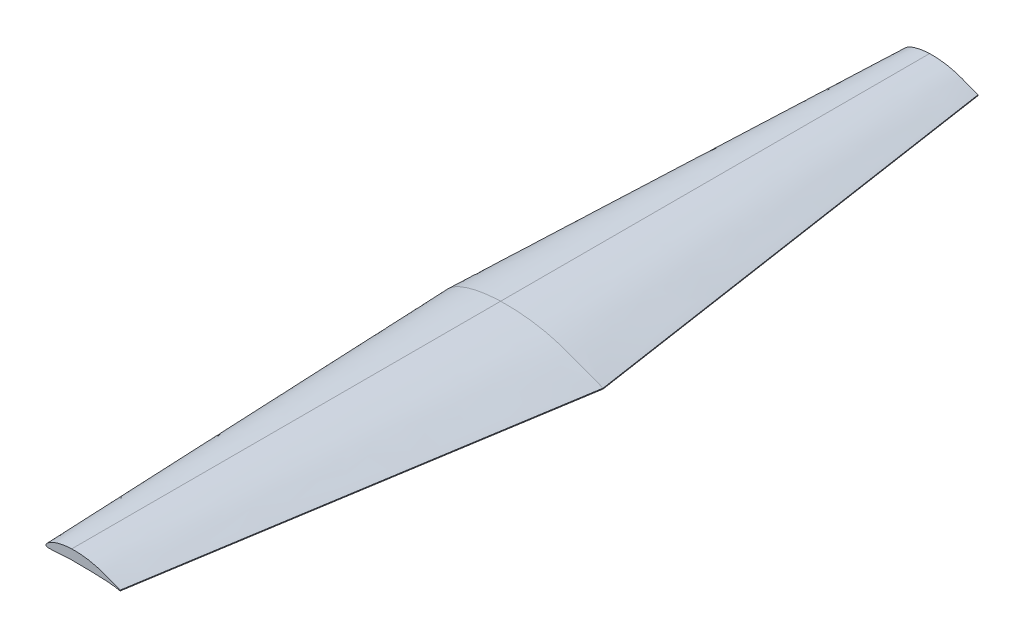
from build123d import *


with BuildPart() as part:
    # 草图8 → 放样2 section 0
    with BuildSketch(Plane.XY.offset(1198)):
        with BuildLine():
            Line((135.209931069, -32.178036718), (135.213870996, -34.389411227))
            add(Edge.make_bspline(
                [(0, 0), (-2.202780391, 0.091358835), (-5.066933977, -0.107193947), (-8.595540889, -0.40058662), (-10.598824702, -0.584365016), (-12.594909645, -0.789363221), (-14.582358537, -1.014151874), (-16.561736061, -1.256795766), (-18.531566578, -1.522769302), (-20.492661157, -1.808349138), (-22.444734443, -2.115732319), (-24.387261164, -2.44474085), (-26.320861136, -2.795884041), (-28.2437018, -3.169577011), (-30.156841195, -3.563009805), (-32.057194603, -3.983448892), (-33.94684572, -4.423220433), (-35.822405413, -4.887724757), (-37.683720928, -5.372265553), (-39.525083517, -5.880876853), (-41.345636367, -6.405162293), (-43.137906373, -6.956708302), (-44.903037206, -7.523443906), (-46.634160328, -8.116953725), (-48.32980777, -8.726761931), (-49.98510916, -9.357484775), (-51.595366468, -10.008335071), (-53.156323053, -10.677771471), (-54.665636895, -11.359543861), (-56.114139393, -12.066874929), (-57.504840801, -12.785022278), (-58.831295239, -13.515210699), (-60.088611751, -14.247465776), (-61.268933962, -14.976942234), (-62.368330165, -15.69098987), (-63.380444878, -16.383167415), (-64.30481932, -17.045044317), (-65.139465709, -17.677475763), (-65.891920358, -18.273720545), (-66.568305414, -18.833500649), (-67.172709641, -19.360583673), (-67.71443902, -19.854042266), (-68.203103927, -20.312676309), (-68.642046763, -20.741820119), (-69.040305995, -21.140628988), (-69.402115625, -21.512434252), (-69.732559053, -21.858727529), (-70.030456468, -22.187324537), (-70.300199908, -22.499385775), (-70.543446323, -22.798645065), (-70.76067965, -23.08787102), (-70.956434934, -23.366848156), (-71.13127491, -23.637367618), (-71.282846404, -23.902645952), (-71.411417301, -24.163194525), (-71.522923974, -24.417240588), (-71.609672251, -24.668765332), (-71.671556616, -24.916361189), (-71.718277745, -25.158309239), (-71.729236703, -25.423881003), (-71.752919399, -25.697565417), (-71.744031425, -25.989631455), (-71.744468982, -26.256218596), (-71.732189572, -26.512056511), (-71.714527731, -26.755218422), (-71.645463866, -26.995423065), (-71.555418319, -27.234948027), (-71.436968717, -27.470675934), (-71.292739306, -27.701213929), (-71.12439285, -27.926520961), (-70.93497885, -28.147839563), (-70.721773473, -28.362361597), (-70.485066327, -28.569235173), (-70.23039799, -28.774915494), (-69.947774897, -28.96783401), (-69.641046574, -29.151737698), (-69.308271189, -29.325926651), (-68.946551815, -29.4856318), (-68.550067334, -29.620133262), (-68.121440872, -29.740942638), (-67.65385036, -29.838832587), (-67.144273887, -29.916721398), (-66.587417435, -29.983504456), (-65.975930951, -30.039405133), (-65.302748448, -30.09517437), (-64.557732475, -30.145396625), (-63.730117595, -30.18196386), (-62.80859823, -30.213152275), (-61.780332898, -30.227118801), (-60.633044068, -30.223118223), (-59.35254531, -30.198077949), (-57.927837896, -30.144124136), (-56.351825826, -30.073031756), (-54.632563698, -29.981677994), (-52.788275227, -29.882850304), (-50.847542509, -29.768183302), (-48.832696889, -29.64386057), (-46.762029284, -29.500079768), (-44.645966559, -29.351697969), (-42.495564653, -29.191088101), (-40.321225615, -29.031280241), (-38.133466545, -28.868275364), (-35.941346143, -28.707234399), (-33.749097924, -28.54899602), (-31.558171008, -28.394570921), (-29.3683878, -28.243897038), (-27.17999416, -28.096664901), (-24.99355742, -27.953882627), (-22.810564332, -27.815408912), (-20.629846742, -27.680783752), (-18.451577761, -27.553739306), (-16.275174836, -27.427618942), (-14.1000592, -27.310976066), (-11.928203446, -27.195365981), (-9.756790356, -27.082668238), (-7.585054768, -26.986688356), (-4.84020886, -26.83660713), (-2.293690571, -26.832659038), (0.192633575, -26.80621402), (2.528388695, -26.775759877), (5.064880595, -26.793829693), (7.656066485, -26.753306062), (9.819586732, -26.734899742), (11.981570719, -26.717954048), (14.14311819, -26.7105429), (16.309111986, -26.702242479), (18.478201845, -26.703109053), (20.652366541, -26.704051385), (22.830601734, -26.714203263), (25.013516351, -26.726726118), (27.199492989, -26.74425363), (29.387291727, -26.766066118), (31.577330769, -26.792367118), (33.767781241, -26.822738074), (35.957232671, -26.855437371), (38.142974754, -26.89238563), (40.324976652, -26.934867183), (42.500023687, -26.97916779), (44.667672301, -27.027727839), (46.827725747, -27.079875173), (48.986401574, -27.133738247), (51.147482045, -27.194798989), (53.317810229, -27.252629519), (55.498215574, -27.322280564), (57.687259084, -27.388908359), (59.880971389, -27.462196173), (62.076359363, -27.538787895), (64.27171153, -27.614949846), (66.465371093, -27.696900971), (68.656226461, -27.78116923), (70.842765027, -27.864607167), (73.022565907, -27.951369884), (75.196846366, -28.041865827), (77.371516617, -28.127318583), (79.549710818, -28.221816362), (81.731130669, -28.312321153), (83.911940369, -28.407022356), (86.088360677, -28.507107951), (88.257018575, -28.609700928), (90.416599377, -28.71673411), (92.565568338, -28.833742766), (94.704030268, -28.954988837), (96.832268594, -29.086660872), (98.948842436, -29.228407609), (101.05615976, -29.378567382), (103.151449358, -29.541433526), (105.238188737, -29.715178714), (107.314091817, -29.904431539), (109.380311723, -30.101652277), (111.433612999, -30.315335325), (113.476042901, -30.544043556), (115.505501179, -30.789189395), (117.520665114, -31.043734188), (119.51623903, -31.318244295), (121.48881211, -31.604655615), (123.433018362, -31.906253356), (125.340662374, -32.223393708), (127.209581947, -32.557856223), (129.034668461, -32.916520553), (130.817570206, -33.292296767), (132.875674245, -33.77223973), (134.335399164, -34.144171736), (135.213870996, -34.389411227)],
                knots=[0, 0, 0, 0, 0.022815026, 0.029793973, 0.036758676, 0.043698396, 0.050624438, 0.057522114, 0.064400195, 0.071258833, 0.078095057, 0.084914364, 0.091711426, 0.098496006, 0.105248918, 0.111987197, 0.118700521, 0.12538957, 0.132045517, 0.138666649, 0.145220531, 0.151712441, 0.158132976, 0.16446531, 0.170709486, 0.176838849, 0.18285338, 0.18873844, 0.194469917, 0.200044378, 0.20547074, 0.210716918, 0.215761415, 0.220573902, 0.225119984, 0.229369276, 0.233302014, 0.236921244, 0.240239232, 0.243267886, 0.246034893, 0.24856357, 0.250874757, 0.252991779, 0.254935992, 0.256725611, 0.258377427, 0.259904748, 0.261329497, 0.262659097, 0.263907391, 0.265083801, 0.266196477, 0.267250058, 0.268253498, 0.269211478, 0.270128622, 0.271011218, 0.271860259, 0.272680143, 0.273766732, 0.27470966, 0.27571044, 0.276533643, 0.277370223, 0.278232175, 0.279115768, 0.28002553, 0.280965187, 0.281935454, 0.282942642, 0.283987031, 0.285072051, 0.28620494, 0.287383253, 0.288620993, 0.289915894, 0.291280333, 0.292721069, 0.294258424, 0.295901055, 0.2976767, 0.299608471, 0.301722499, 0.304050746, 0.306620881, 0.30947361, 0.312650372, 0.316192577, 0.32014851, 0.324560292, 0.329487536, 0.334948887, 0.340937813, 0.347360694, 0.354122343, 0.361120111, 0.368316957, 0.375670101, 0.383141402, 0.390702936, 0.398303336, 0.40591601, 0.413521193, 0.4211208, 0.428716972, 0.436307608, 0.443890394, 0.451463234, 0.459015333, 0.466572018, 0.47411479, 0.481646979, 0.489184806, 0.496693366, 0.504218963, 0.511752726, 0.525226611, 0.530645438, 0.537566507, 0.549475995, 0.556976056, 0.564468775, 0.571936885, 0.579420773, 0.586908434, 0.594422732, 0.601938595, 0.609478945, 0.617035725, 0.624600336, 0.632172809, 0.639748912, 0.647337287, 0.654914587, 0.66248067, 0.670031225, 0.677570761, 0.68506504, 0.69253974, 0.700001338, 0.707481727, 0.714983389, 0.722539991, 0.73012854, 0.737718905, 0.745326127, 0.752933269, 0.760523089, 0.768114907, 0.775693893, 0.783238596, 0.790761854, 0.798285167, 0.805831766, 0.813395456, 0.8209505, 0.828492594, 0.836013266, 0.843489046, 0.850939181, 0.858355231, 0.865724552, 0.873075067, 0.880377055, 0.887656479, 0.894892271, 0.90211478, 0.909296178, 0.916439553, 0.923545459, 0.930631395, 0.937660861, 0.944631335, 0.951542678, 0.958353151, 0.965055621, 0.971617827, 0.978062285, 0.984364015, 0.990532122, 1, 1, 1, 1], degree=3))
            add(Edge.make_bspline(
                [(0, 0), (1.364177383, -0.043580484), (3.40511211, 0.031785466), (6.126174412, 0.046317508), (8.163369993, 0.042034579), (10.202341065, 0.024632669), (12.243632765, -0.014718201), (14.285791623, -0.071535099), (16.33005737, -0.141611523), (18.374864569, -0.233782806), (20.420336352, -0.33952236), (22.466615554, -0.461741022), (24.512326345, -0.604724804), (26.557931093, -0.759082618), (28.602909036, -0.932219371), (30.646686054, -1.122867063), (32.690051754, -1.327460959), (34.730959589, -1.551335071), (36.769855137, -1.787232728), (38.805253719, -2.043785452), (40.837281962, -2.312141876), (42.86440918, -2.600154373), (44.885925913, -2.900137538), (46.899623365, -3.218777349), (48.906543004, -3.553138057), (50.90668819, -3.908855135), (52.902158516, -4.277915924), (54.890413346, -4.667021702), (56.872665333, -5.072059584), (58.848118799, -5.49945616), (60.81994798, -5.94113471), (62.786078547, -6.406405579), (64.749272393, -6.886045719), (66.708203306, -7.388321513), (68.664194752, -7.907189189), (70.616577724, -8.444276181), (72.565250087, -9.000437135), (74.511299909, -9.577544795), (76.455756627, -10.171074315), (78.40052315, -10.783255133), (80.34437156, -11.419751661), (82.294354664, -12.069499879), (84.248540115, -12.743775362), (86.211553287, -13.4371317), (88.185525617, -14.144718735), (90.169632588, -14.87147557), (92.164798795, -15.614273969), (94.173103566, -16.368816428), (96.190660078, -17.135391658), (98.214444653, -17.90699033), (100.239036083, -18.684211238), (102.263137267, -19.463565274), (104.291890319, -20.241303458), (106.326485515, -21.026488563), (108.37158412, -21.811343877), (110.422710682, -22.598834241), (112.476717862, -23.387201909), (114.5322703, -24.171762643), (116.585411889, -24.954501881), (118.634417569, -25.733588716), (120.677366225, -26.503975919), (122.707346352, -27.271641379), (124.718603391, -28.025197231), (126.697129524, -28.774077744), (128.6346755, -29.515303083), (130.524957495, -30.254339005), (132.714523361, -31.133421324), (134.270056434, -31.776449602), (135.209931069, -32.178036718)],
                knots=[0, 0, 0, 0, 0.029181925, 0.043684306, 0.05821854, 0.072769694, 0.087310923, 0.101901178, 0.116480204, 0.131074947, 0.145695494, 0.160303153, 0.174934264, 0.189571701, 0.20419485, 0.218844298, 0.233489695, 0.248132595, 0.262772927, 0.277404235, 0.292025903, 0.306627086, 0.321211566, 0.335751321, 0.350247482, 0.364742609, 0.379217205, 0.393665958, 0.408089509, 0.42250488, 0.436909904, 0.451323334, 0.465733172, 0.480149118, 0.494591476, 0.50903039, 0.523473295, 0.53794923, 0.552459595, 0.566971359, 0.58157126, 0.596222383, 0.610947788, 0.625801042, 0.640765661, 0.655813942, 0.671010731, 0.686316459, 0.701716069, 0.717189064, 0.732657604, 0.748116304, 0.763595919, 0.779144946, 0.794777511, 0.810464338, 0.826153996, 0.841850806, 0.857539391, 0.873166992, 0.888753242, 0.90425474, 0.919602178, 0.934707133, 0.949517979, 0.96398757, 0.97813205, 1, 1, 1, 1], degree=3))
        make_face()
    # 草图3 → 放样2 section 1
    with BuildSketch(Plane.XY):
        with BuildLine():
            Line((286.055608228, -67.209266366), (286.055608228, -69.532766948))
            add(Edge.make_bspline(
                [(0, 0), (-2.725444694, 0.16479075), (-6.529329099, -0.138331244), (-11.397016018, -0.405348512), (-15.713874629, -0.64444661), (-21.121913216, -1.041627107), (-27.619648691, -1.602920243), (-34.105982036, -2.270964793), (-40.579797503, -3.043587525), (-47.038279723, -3.931652037), (-53.479734263, -4.935955417), (-58.854414584, -5.877356762), (-63.169985024, -6.70024074), (-66.434425741, -7.357914384), (-69.691963936, -8.046339188), (-72.941077321, -8.77256441), (-76.183155264, -9.529979299), (-79.417200801, -10.323559167), (-82.671188627, -11.161789957), (-85.94521275, -12.041440017), (-89.23632109, -12.971017746), (-92.514827659, -13.941881935), (-95.77914161, -14.959856385), (-99.028801968, -16.02419143), (-102.262401726, -17.140269432), (-104.962526081, -18.121694649), (-107.136544699, -18.945165575), (-108.791541193, -19.589414389), (-110.439200679, -20.250087878), (-112.080238251, -20.92601665), (-113.436360447, -21.514562153), (-114.799567501, -22.084744275), (-116.429788539, -22.849639447), (-118.360299468, -23.734628468), (-120.291408253, -24.685432883), (-121.948548066, -25.524658599), (-123.593652926, -26.392003285), (-125.229519218, -27.284016058), (-126.855596581, -28.204859765), (-128.517200827, -29.17741547), (-130.21083081, -30.205442861), (-131.930502415, -31.291558288), (-133.628269536, -32.406389376), (-135.298492236, -33.546499842), (-136.932725116, -34.7128219), (-138.527730347, -35.899250832), (-139.87977025, -36.956117217), (-141.006081118, -37.869529498), (-141.921591236, -38.637405862), (-142.830664323, -39.425208217), (-143.739703161, -40.239219522), (-144.656101653, -41.085997114), (-145.586401749, -41.971657092), (-146.641442979, -43.003756741), (-147.814027187, -44.186443378), (-149.051137738, -45.534471175), (-150.183287122, -46.937773376), (-151.137791588, -48.380311299), (-151.835733309, -49.854011685), (-152.197950673, -51.357874625), (-152.116377567, -52.6851503), (-151.736524949, -53.757901692), (-151.248705518, -54.622813972), (-150.621080517, -55.444995082), (-149.875697311, -56.210818528), (-149.041156237, -56.910942554), (-148.141407974, -57.531735767), (-147.234879227, -58.042067674), (-146.342332479, -58.446578755), (-145.47686329, -58.760343946), (-144.603345187, -59.009285546), (-143.724303936, -59.208245301), (-142.839292945, -59.363577497), (-141.950551403, -59.490451701), (-140.825929854, -59.622495162), (-139.464937172, -59.764274743), (-137.865807953, -59.901840496), (-136.262207013, -60.012543487), (-134.655562674, -60.098283022), (-133.046632135, -60.161490781), (-131.436429613, -60.202280242), (-129.825050101, -60.223598267), (-128.213228638, -60.225210722), (-126.601727435, -60.211439507), (-124.991342664, -60.182816005), (-123.381767087, -60.144170461), (-121.772547624, -60.094255948), (-120.163299382, -60.039622339), (-118.553272856, -59.97874382), (-116.405135775, -59.897052051), (-114.25630744, -59.809563299), (-112.107687845, -59.718305361), (-110.496074249, -59.646015596), (-108.884224596, -59.573015661), (-106.733902854, -59.468520942), (-104.045134479, -59.333058566), (-100.818867527, -59.158040382), (-97.593531503, -58.974317976), (-94.368955004, -58.783136756), (-91.144489426, -58.588261445), (-87.919549107, -58.391747611), (-84.694353955, -58.193400641), (-81.468682834, -57.998554673), (-78.243570418, -57.803396432), (-75.018468811, -57.612070176), (-71.793569138, -57.423092565), (-68.568002165, -57.239451184), (-65.342134172, -57.055873416), (-60.889689655, -56.811968085), (-50.4823717, -56.256797171), (-39.738024807, -55.760868752), (-29.145608314, -55.318080066), (-23.436100514, -55.100144163), (-16.989096881, -54.871193717), (-10.544531059, -54.66752336), (-5.216141596, -54.511600586), (24.816205374, -53.75116662), (54.864063261, -53.785828636), (86.007749154, -54.171705504), (92.437398561, -54.267447737), (98.866042453, -54.377966038), (104.734565572, -54.492454463), (115.492942115, -54.724826001), (126.206565517, -55.000515422), (137.477971799, -55.333491378), (143.859380276, -55.531056564), (149.213526009, -55.702096911), (153.497044422, -55.845713453), (156.069039561, -55.929977897), (159.282488984, -56.03977671), (163.567567314, -56.184372648), (169.564265612, -56.392746778), (175.989918576, -56.62458583), (182.413470777, -56.87486903), (188.835284325, -57.150500523), (195.255523834, -57.455959443), (201.674688689, -57.802575463), (208.095271976, -58.19482851), (214.515615191, -58.640093564), (220.933950248, -59.145085891), (227.347072378, -59.706320062), (233.754357613, -60.33612596), (240.156440818, -61.030450763), (246.55286602, -61.79900368), (251.884892916, -62.503528456), (256.155563709, -63.106980732), (259.366061645, -63.58860377), (262.570233843, -64.102835954), (265.766684956, -64.655259055), (268.953024845, -65.255025736), (272.128277639, -65.907077835), (275.311127883, -66.622757601), (278.499849813, -67.406872411), (282.09048433, -68.371672385), (284.615229937, -69.061847319), (286.055608228, -69.532766948)],
                knots=[0, 0, 0, 0, 0.013429266, 0.018716729, 0.024004191, 0.034706079, 0.045405056, 0.05610273, 0.066797979, 0.077492536, 0.088187468, 0.098882888, 0.104346572, 0.10981022, 0.115272402, 0.120733356, 0.126196006, 0.131658689, 0.137122536, 0.142734056, 0.148343908, 0.153954022, 0.159562374, 0.165172765, 0.170783601, 0.176398138, 0.179312148, 0.182225445, 0.185138958, 0.188049197, 0.190960188, 0.192414974, 0.195321254, 0.199821328, 0.202867385, 0.205914523, 0.208963571, 0.212020289, 0.215084818, 0.218160637, 0.221495947, 0.224835492, 0.22817077, 0.231492007, 0.234787969, 0.238051825, 0.241275187, 0.243233433, 0.245188895, 0.247155989, 0.249153783, 0.251194383, 0.25329682, 0.255475443, 0.258458465, 0.261492958, 0.264476844, 0.267324326, 0.269987635, 0.272465074, 0.274860746, 0.276409009, 0.278031414, 0.279729108, 0.281486084, 0.28328071, 0.285082355, 0.286858664, 0.288393505, 0.289900318, 0.291385352, 0.292861116, 0.294334247, 0.295806564, 0.297279135, 0.299907183, 0.302541073, 0.30517838, 0.30781824, 0.310459636, 0.313103075, 0.315745669, 0.318391033, 0.321035997, 0.323677343, 0.326318213, 0.328960244, 0.331601385, 0.334243176, 0.336890139, 0.342181748, 0.34482804, 0.347474762, 0.350121774, 0.35276938, 0.358070712, 0.36337214, 0.368671762, 0.373970917, 0.379270748, 0.384570921, 0.389872896, 0.39517453, 0.400475993, 0.405775316, 0.411075767, 0.416375555, 0.421676645, 0.426978555, 0.438322481, 0.472972246, 0.479915504, 0.490501855, 0.501093745, 0.511666367, 0.522236565, 0.527330213, 0.659527064, 0.670077962, 0.680626484, 0.691175966, 0.701723186, 0.70951569, 0.744138977, 0.754470581, 0.765015594, 0.775562088, 0.780836092, 0.786110096, 0.788227744, 0.796661303, 0.807212434, 0.817760151, 0.828307694, 0.838851851, 0.849396098, 0.859942466, 0.87049153, 0.881055602, 0.891617635, 0.902178563, 0.91273989, 0.923304472, 0.933872558, 0.944447572, 0.949775125, 0.955100631, 0.960425594, 0.965746938, 0.971065681, 0.976382904, 0.981700186, 0.98712133, 0.992543081, 1, 1, 1, 1], degree=3))
            add(Edge.make_bspline(
                [(286.055608228, -67.209266366), (284.644285935, -66.597802105), (282.175461463, -65.54729581), (278.640882203, -64.076687559), (275.474642785, -62.790366989), (272.312196321, -61.543783056), (269.156931358, -60.329386909), (265.9936918, -59.136276991), (262.824387684, -57.95851836), (259.650155279, -56.793515297), (256.474382905, -55.630992907), (252.239434164, -54.082740818), (246.951126246, -52.136508839), (240.614746748, -49.780972664), (234.283971005, -47.415332102), (227.956938485, -45.040508925), (221.63236241, -42.658373138), (215.306391481, -40.274601471), (208.989812562, -37.894863302), (202.681199965, -35.525199799), (196.378289161, -33.176735586), (190.065615766, -30.858949911), (183.961366382, -28.658371966), (179.560051762, -27.121665131), (176.607497155, -26.099380522), (174.259554435, -25.311482978), (170.186568218, -23.919973411), (166.22583865, -22.623839086), (161.874049685, -21.285002204), (158.736648193, -20.291488778), (155.066777624, -19.22726589), (150.974926486, -18.006068596), (145.68897099, -16.544874515), (139.327053916, -14.862297703), (132.939676049, -13.276922811), (126.529144262, -11.784264987), (120.131390676, -10.395283622), (113.749672512, -9.107213058), (107.386282088, -7.918704488), (101.007785919, -6.820773201), (94.615506116, -5.805295025), (88.209809749, -4.87613039), (81.791827945, -4.026562677), (75.376371972, -3.256796096), (68.96550657, -2.562132424), (62.561185069, -1.945375189), (56.15160193, -1.404040156), (49.736640637, -0.939479239), (43.316233695, -0.553304169), (36.890458068, -0.244055135), (30.457474332, -0.015719002), (24.019331444, 0.134254504), (17.577599083, 0.200126776), (9.570522066, 0.186052889), (3.712392232, 0.037127334), (0, 0)],
                knots=[0, 0, 0, 0, 0.015566346, 0.027153379, 0.038744417, 0.050153436, 0.061555457, 0.07296076, 0.084368596, 0.0957737, 0.107181142, 0.118595016, 0.141408301, 0.164211232, 0.187010579, 0.209806491, 0.232606534, 0.255408676, 0.278223642, 0.300920337, 0.323611108, 0.346296669, 0.368978322, 0.389280516, 0.393477088, 0.400600193, 0.41434499, 0.43703786, 0.442772015, 0.460424951, 0.470341709, 0.481442265, 0.503641346, 0.525840621, 0.548041443, 0.570243891, 0.592452205, 0.614296317, 0.636130775, 0.657964773, 0.679797813, 0.701633714, 0.723470751, 0.745316508, 0.767026059, 0.78873077, 0.810430305, 0.832124225, 0.853822329, 0.87552444, 0.897230427, 0.918967256, 0.940698024, 0.962426571, 1, 1, 1, 1], degree=3))
        make_face()
    loft_2 = loft()

    # 镜向5: 放样2 across plane
    add(loft_2.mirror(Plane(origin=(-17.651336659, -54.897749293, 0), x_dir=(1, 0, 0), z_dir=(0, 0, -1))))


solid = part.part
